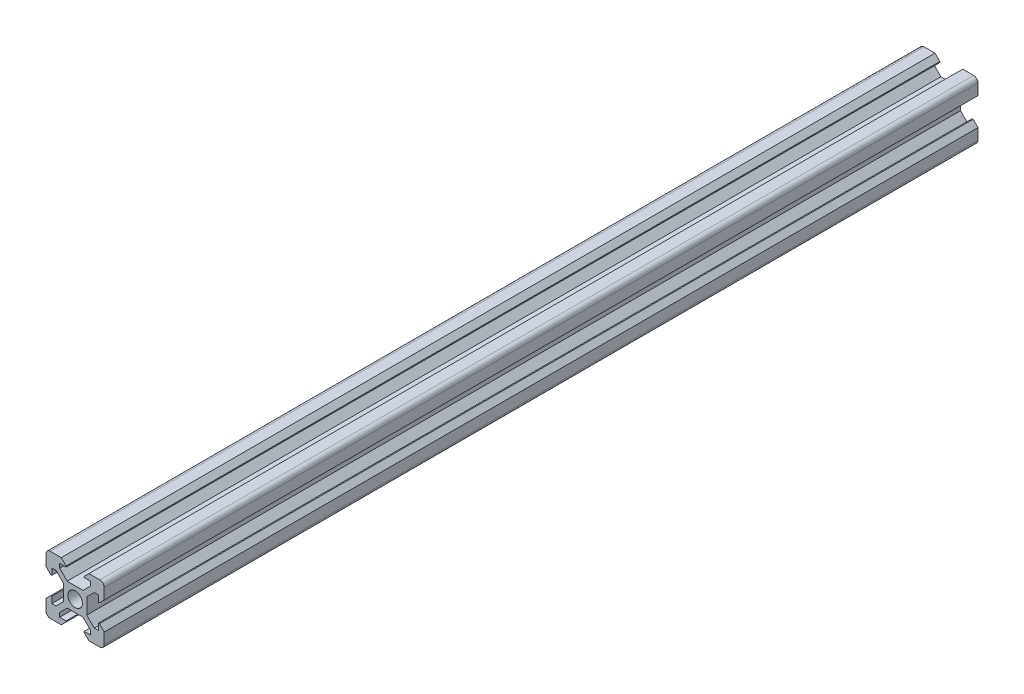
from build123d import *

# Parameters (mm, degrees)
SKETCH2_R           = 2.5
BOSS_EXTRUDE1_DEPTH = 300


with BuildPart() as part:
    # Sketch2 → Boss-Extrude1 (new body)
    with BuildSketch(Plane.XY):
        with BuildLine():
            Line((-4, -2.727207794), (-4, 2.727207794))
            Line((-4, 2.727207794), (-6.572792206, 5.3))
            Line((-6.572792206, 5.3), (-8, 5.3))
            Line((-8, 5.3), (-8, 3.1))
            Line((-8, 3.1), (-8.35, 3.1))
            Line((-8.35, 3.1), (-10, 4.75))
            Line((-10, 4.75), (-10, 8.5))
            ThreePointArc((-10, 8.5), (-9.560660172, 9.560660172), (-8.5, 10))
            Line((-8.5, 10), (-4.75, 10))
            Line((-4.75, 10), (-3.1, 8.35))
            Line((-3.1, 8.35), (-3.1, 8))
            Line((-3.1, 8), (-5.3, 8))
            Line((-5.3, 8), (-5.3, 6.572792206))
            Line((-5.3, 6.572792206), (-2.727207794, 4))
            Line((-2.727207794, 4), (2.727207794, 4))
            Line((2.727207794, 4), (5.3, 6.572792206))
            Line((5.3, 6.572792206), (5.3, 8))
            Line((5.3, 8), (3.1, 8))
            Line((3.1, 8), (3.1, 8.35))
            Line((3.1, 8.35), (4.75, 10))
            Line((4.75, 10), (8.5, 10))
            ThreePointArc((8.5, 10), (9.560660172, 9.560660172), (10, 8.5))
            Line((10, 8.5), (10, 4.75))
            Line((10, 4.75), (8.35, 3.1))
            Line((8.35, 3.1), (8, 3.1))
            Line((8, 3.1), (8, 5.3))
            Line((8, 5.3), (6.572792206, 5.3))
            Line((6.572792206, 5.3), (4, 2.727207794))
            Line((4, 2.727207794), (4, -2.727207794))
            Line((4, -2.727207794), (6.572792206, -5.3))
            Line((6.572792206, -5.3), (8, -5.3))
            Line((8, -5.3), (8, -3.1))
            Line((8, -3.1), (8.35, -3.1))
            Line((8.35, -3.1), (10, -4.75))
            Line((10, -4.75), (10, -8.5))
            ThreePointArc((10, -8.5), (9.560660172, -9.560660172), (8.5, -10))
            Line((8.5, -10), (4.75, -10))
            Line((4.75, -10), (3.1, -8.35))
            Line((3.1, -8.35), (3.1, -8))
            Line((3.1, -8), (5.3, -8))
            Line((5.3, -8), (5.3, -6.572792206))
            Line((5.3, -6.572792206), (2.727207794, -4))
            Line((2.727207794, -4), (-2.727207794, -4))
            Line((-2.727207794, -4), (-5.3, -6.572792206))
            Line((-5.3, -6.572792206), (-5.3, -8))
            Line((-5.3, -8), (-3.1, -8))
            Line((-3.1, -8), (-3.1, -8.35))
            Line((-3.1, -8.35), (-4.75, -10))
            Line((-4.75, -10), (-8.5, -10))
            ThreePointArc((-8.5, -10), (-9.560660172, -9.560660172), (-10, -8.5))
            Line((-10, -8.5), (-10, -4.75))
            Line((-10, -4.75), (-8.35, -3.1))
            Line((-8.35, -3.1), (-8, -3.1))
            Line((-8, -3.1), (-8, -5.3))
            Line((-8, -5.3), (-6.572792206, -5.3))
            Line((-6.572792206, -5.3), (-4, -2.727207794))
        make_face()
        Circle(SKETCH2_R, mode=Mode.SUBTRACT)
    extrude(amount=BOSS_EXTRUDE1_DEPTH)


solid = part.part
